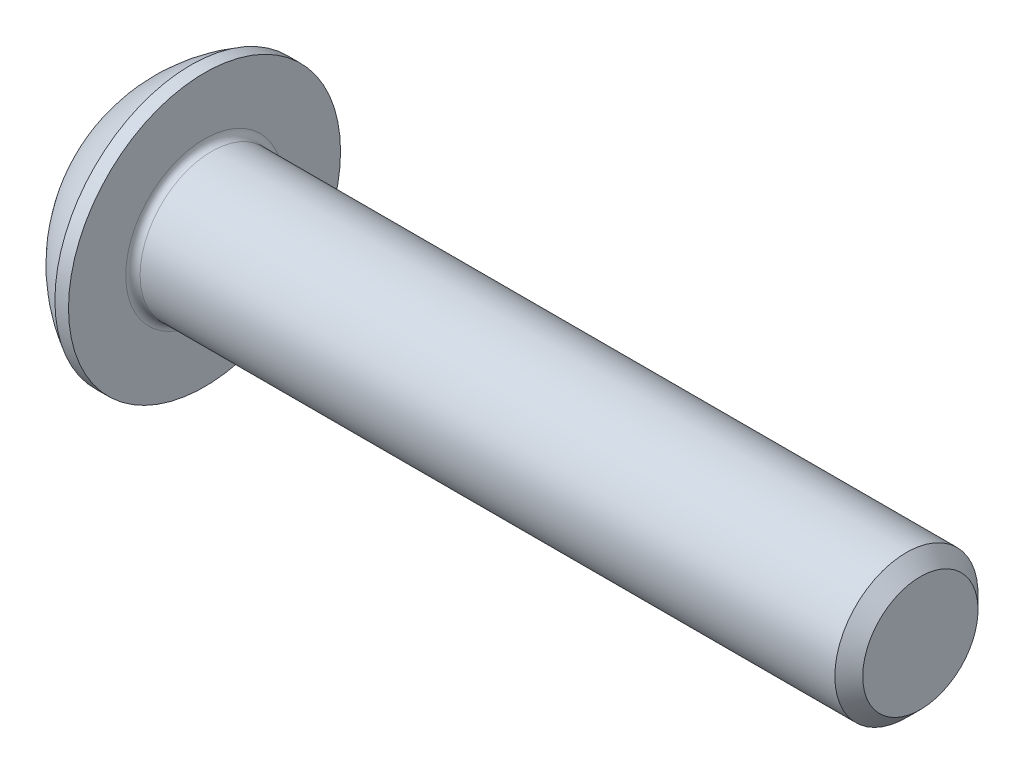
from build123d import *

# Parameters (mm, degrees)
FILLET1_R   = 0.2
HEX_2_DEPTH = 1.3


with BuildPart() as part:
    # BodySke → BaseBody (revolve)
    with BuildSketch(Plane.XY, mode=Mode.PRIVATE) as basebody_sk:
        with BuildLine():
            Line((22.2, 0), (22.2, 1.61))
            Line((22.2, 1.61), (21.81, 2))
            Line((21.81, 2), (2.2, 2))
            Line((2.2, 2), (2.2, 3.8))
            Line((2.2, 3.8), (1.82, 3.8))
            ThreePointArc((1.82, 3.8), (0.762013659, 2.991755338), (0, 1.9))
            Line((0, 1.9), (0, 0))
            Line((0, 0), (22.2, 0))
        make_face()
    revolve(basebody_sk.sketch.rotate(Axis((0, 0, 0), (1, 0, 0)), 90), axis=Axis((0, 0, 0), (1, 0, 0)))

    # Fillet1
    fillet1_edges = [part.edges().sort_by_distance(p)[0] for p in [
        (2.2, 0, -2),
    ]]
    fillet(fillet1_edges, radius=FILLET1_R)

    # Sketch2 → PreBroach (revolve, cut)
    with BuildSketch(Plane.XY, mode=Mode.PRIVATE) as prebroach_sk:
        Polygon((0, 1.25), (1.3, 1.25), (2.021687836, 0), (0, 0), align=None)
    revolve(prebroach_sk.sketch.rotate(Axis((0, 0, 0), (1, 0, 0)), 90), axis=Axis((0, 0, 0), (1, 0, 0)), mode=Mode.SUBTRACT)

    # Sketch3 → Hex 2 (cut)
    with BuildSketch(Plane(origin=(0, 0, 0), x_dir=(0, 0, -1), z_dir=(1, 0, 0))):
        Polygon((-1.25, -0.721687836), (-1.25, 0.721687836), (0, 1.443375673), (1.25, 0.721687836), (1.25, -0.721687836), (0, -1.443375673), align=None)
    extrude(amount=HEX_2_DEPTH, mode=Mode.SUBTRACT)


solid = part.part
